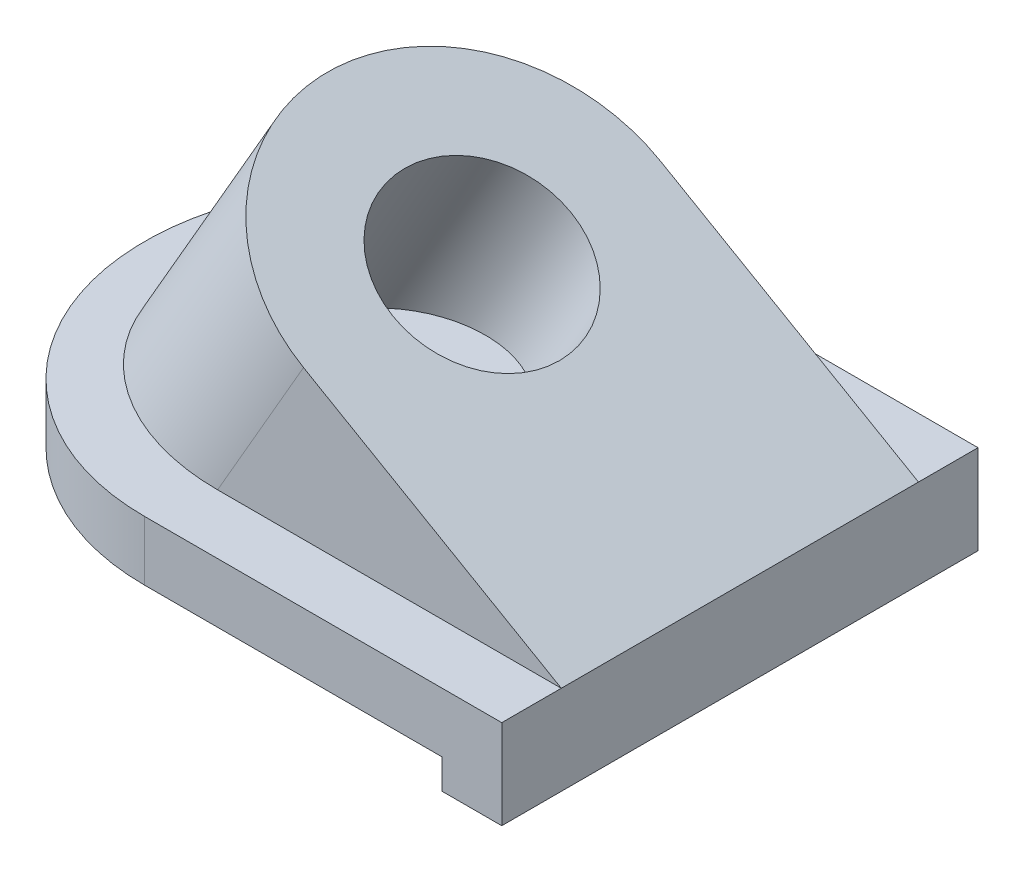
from build123d import *

# Parameters (mm, degrees)
BOSS_EXTRUDE1_DEPTH = 12.7
SKETCH2_W           = 12.7
SKETCH2_H           = 6.35
BOSS_EXTRUDE2_DEPTH = 101.6
BOSS_EXTRUDE3_REACH = 105.182
SKETCH3_R           = 19.05


with BuildPart() as part:
    # Sketch1 → Boss-Extrude1 (new body)
    with BuildSketch(Plane(origin=(0, 0, 0), x_dir=(1, 0, 0), z_dir=(0, 1, 0))):
        with BuildLine():
            Line((0, 50.8), (76.2, 50.8))
            Line((76.2, 50.8), (76.2, -50.8))
            Line((76.2, -50.8), (0, -50.8))
            ThreePointArc((0, -50.8), (-50.8, 0), (0, 50.8))
        make_face()
    extrude(amount=BOSS_EXTRUDE1_DEPTH)

    # Sketch2 → Boss-Extrude2 (add)
    with BuildSketch(Plane.XY.offset(50.8)):
        with Locations((69.85, -3.175)):
            Rectangle(SKETCH2_W, SKETCH2_H)
    extrude(amount=-BOSS_EXTRUDE2_DEPTH)

    # Boss-Extrude3: up to this face of the body (flat: up to its plane)
    boss_extrude3_end = Plane(part.part.faces().sort_by_distance((17.597225425, 12.7, 0))[0])
    # Sketch3 → Boss-Extrude3 (add, up to the picked face)
    with BuildSketch(Plane(origin=(24.549261314, 42.520567884, 0), x_dir=(0, 0, -1), z_dir=(0.500000000000001, 0.866025403784438, 0)), mode=Mode.PRIVATE) as boss_extrude3_sk1:
        with BuildLine():
            Line((-38.1, 3.858864232), (-38.1, -59.641135768))
            Line((-38.1, -59.641135768), (38.1, -59.641135768))
            Line((38.1, -59.641135768), (38.1, 3.858864232))
            ThreePointArc((38.1, 3.858864232), (0, 41.958864232), (-38.1, 3.858864232))
        make_face()
        with Locations((0, 3.858864232)):
            Circle(SKETCH3_R, mode=Mode.SUBTRACT)
    boss_extrude3_tool1 = split(extrude(boss_extrude3_sk1.sketch, amount=-BOSS_EXTRUDE3_REACH, mode=Mode.PRIVATE), bisect_by=boss_extrude3_end, keep=Keep.BOTH, mode=Mode.PRIVATE)
    add(boss_extrude3_tool1.solids().sort_by(Axis((38.119708, 34.685667, 0), (-0.500000000000001, -0.866025403784438, 0)))[0])


solid = part.part
